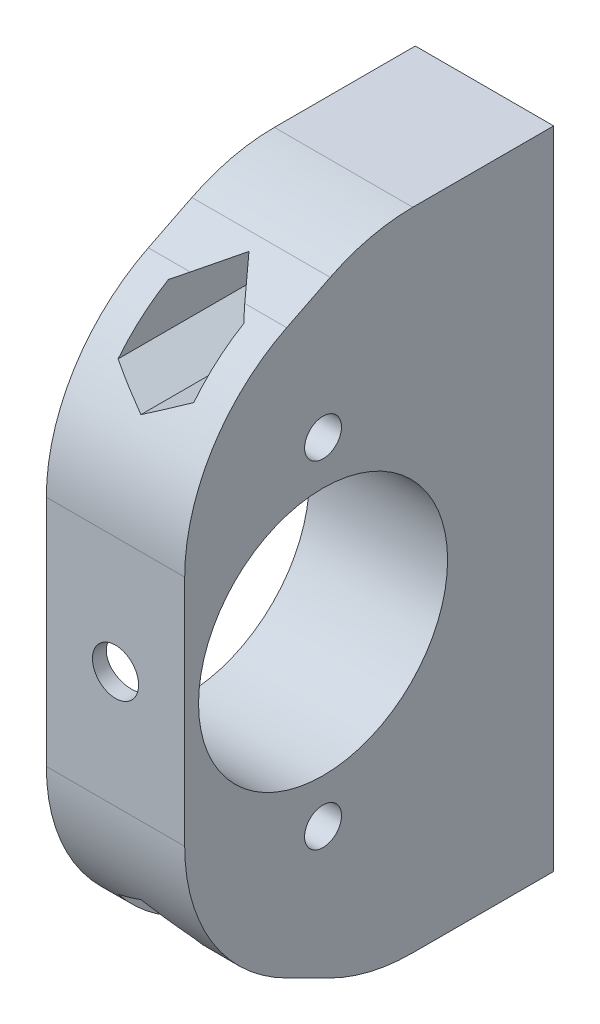
from build123d import *

# Parameters (mm, degrees)
SKETCH1_R           = 2
SKETCH1_R_2         = 13.5
BOSS_EXTRUDE1_DEPTH = 7.5
SKETCH2_R           = 2.6
CUT_EXTRUDE1_DEPTH  = 20
SKETCH4_R           = 2.5
CUT_EXTRUDE2_DEPTH  = 10
SKETCH2_3_R         = 2.6
CUT_EXTRUDE3_DEPTH  = 54.677276398


with BuildPart() as part:
    # Sketch1 → Boss-Extrude1 (new, symmetric)
    with BuildSketch(Plane(origin=(0, 0, 0), x_dir=(0, 0, -1), z_dir=(1, 0, 0))):
        with BuildLine():
            Line((24.999999999, 35), (9.721359549, 35))
            ThreePointArc((9.721359549, 35), (5.126301138, 34.464979789), (0.777087639, 32.88854382))
            Line((0.777087639, 32.88854382), (-3.944271911, 30.527864045))
            ThreePointArc((-3.944271911, 30.527864045), (-12.013016168, 23.153942467), (-15.000000001, 12.639320225))
            Line((-15.000000001, 12.639320225), (-15.000000001, -12.639320225))
            ThreePointArc((-15.000000001, -12.639320225), (-12.013016168, -23.153942467), (-3.944271911, -30.527864045))
            Line((-3.944271911, -30.527864045), (0.777087639, -32.88854382))
            ThreePointArc((0.777087639, -32.88854382), (5.126301138, -34.464979789), (9.721359549, -35))
            Line((9.721359549, -35), (24.999999999, -35))
            Line((24.999999999, -35), (24.999999999, 35))
        make_face()
        with Locations((0, 18.25)):
            Circle(SKETCH1_R, mode=Mode.SUBTRACT)
        Circle(SKETCH1_R_2, mode=Mode.SUBTRACT)
        with Locations((0, -18.25)):
            Circle(SKETCH1_R, mode=Mode.SUBTRACT)
    extrude(amount=BOSS_EXTRUDE1_DEPTH, both=True)

    # Sketch2 → Cut-Extrude1 (cut)
    # profile 1 of 2: a face of its own
    with BuildSketch(Plane.XY.offset(15.000000001)):
        Polygon((0, -22.765727793), (-4.1, -25.132863896), (-4.1, -29.867136104), (0, -32.234272207), (4.1, -29.867136104), (4.1, -25.132863896), align=None)
        with Locations((0, -27.5)):
            Circle(SKETCH2_R, mode=Mode.SUBTRACT)
    # profile 2 of 2: a face of its own
    with BuildSketch(Plane.XY.offset(15.000000001)):
        Polygon((0, 32.234272207), (-4.1, 29.867136104), (-4.1, 25.132863896), (0, 22.765727793), (4.1, 25.132863896), (4.1, 29.867136104), align=None)
        with Locations((0, 27.5)):
            Circle(SKETCH2_R, mode=Mode.SUBTRACT)
    extrude(amount=-CUT_EXTRUDE1_DEPTH, mode=Mode.SUBTRACT)

    # Sketch4 → Cut-Extrude2 (cut)
    with BuildSketch(Plane.XY.offset(15.000000001)):
        Circle(SKETCH4_R)
    extrude(amount=-CUT_EXTRUDE2_DEPTH, mode=Mode.SUBTRACT)

    # Sketch2<3> → Cut-Extrude3 (cut, through all)
    with BuildSketch(Plane.XY.offset(15.000000001)):
        with Locations((0, 27.5)):
            Circle(SKETCH2_3_R)
        with Locations((0, -27.5)):
            Circle(SKETCH2_3_R)
    extrude(amount=-CUT_EXTRUDE3_DEPTH, mode=Mode.SUBTRACT)


solid = part.part
